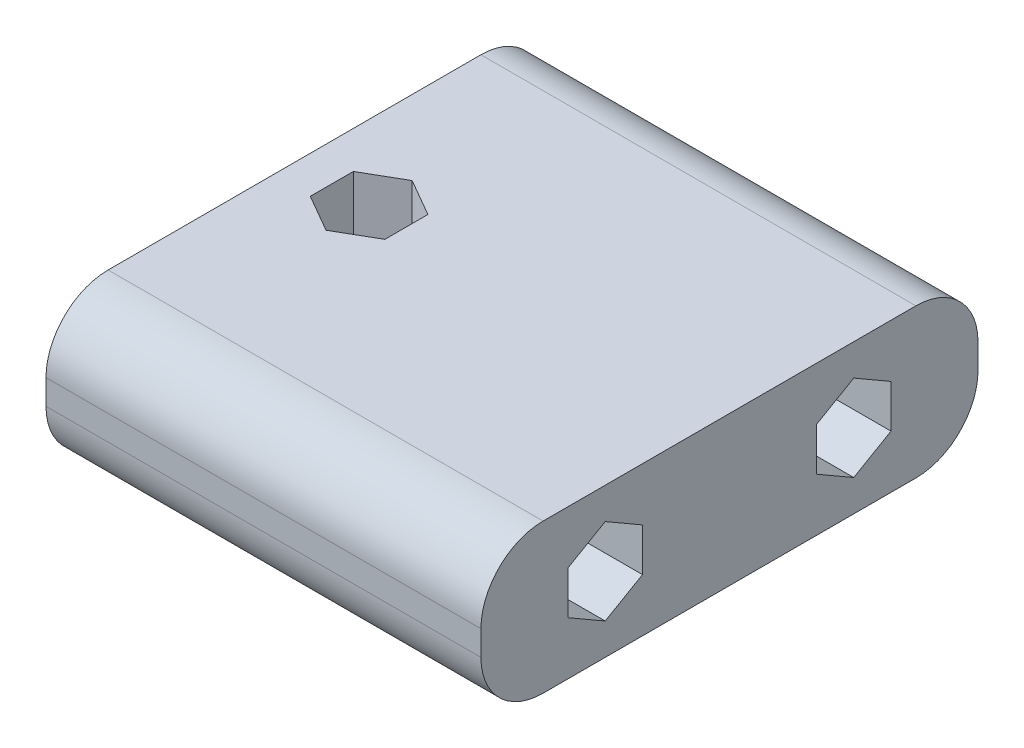
from build123d import *

# Parameters (mm, degrees)
SKETCH_2_W          = 40
SKETCH_2_H          = 12
EXTRUDE_1_DEPTH     = 35
FILLET_1_R          = 5
CUT_EXTRUDE_1_DEPTH = 20
EXTRUDE_2_DEPTH     = 10


with BuildPart() as part:
    # 草图2 → 凸台-拉伸1 (new body)
    with BuildSketch(Plane(origin=(0, 0, 0), x_dir=(0, 0, -1), z_dir=(1, 0, 0))):
        with Locations((20, 6)):
            Rectangle(SKETCH_2_W, SKETCH_2_H)
        Polygon((10, 9.464101615), (7, 7.732050808), (7, 4.267949192), (10, 2.535898385), (13, 4.267949192), (13, 7.732050808), align=None, mode=Mode.SUBTRACT)
        Polygon((30, 9.464101615), (27, 7.732050808), (27, 4.267949192), (30, 2.535898385), (33, 4.267949192), (33, 7.732050808), align=None, mode=Mode.SUBTRACT)
    extrude(amount=EXTRUDE_1_DEPTH)

    # 圆角1
    fillet_1_edges = [part.edges().sort_by_distance(p)[0] for p in [
        (17.5, 12, 0),
        (17.5, 12, -40),
        (17.5, 0, -40),
        (17.5, 0, 0),
    ]]
    fillet(fillet_1_edges, radius=FILLET_1_R)

    # 草图3 → 切除-拉伸1 (cut)
    with BuildSketch(Plane.XZ):
        Polygon((6, -16.535898385), (3, -18.267949192), (3, -21.732050808), (6, -23.464101615), (9, -21.732050808), (9, -18.267949192), align=None)
    extrude(amount=-CUT_EXTRUDE_1_DEPTH, mode=Mode.SUBTRACT)

    # 草图4 → 凸台-拉伸2 (add)
    with BuildSketch(Plane.ZY):
        Polygon((-30, 9.464101615), (-27, 7.732050808), (-27, 4.267949192), (-30, 2.535898385), (-33, 4.267949192), (-33, 7.732050808), align=None)
        Polygon((-7, 7.732050808), (-7, 4.267949192), (-10, 2.535898385), (-13, 4.267949192), (-13, 7.732050808), (-10, 9.464101615), align=None)
    extrude(amount=-EXTRUDE_2_DEPTH)


solid = part.part
